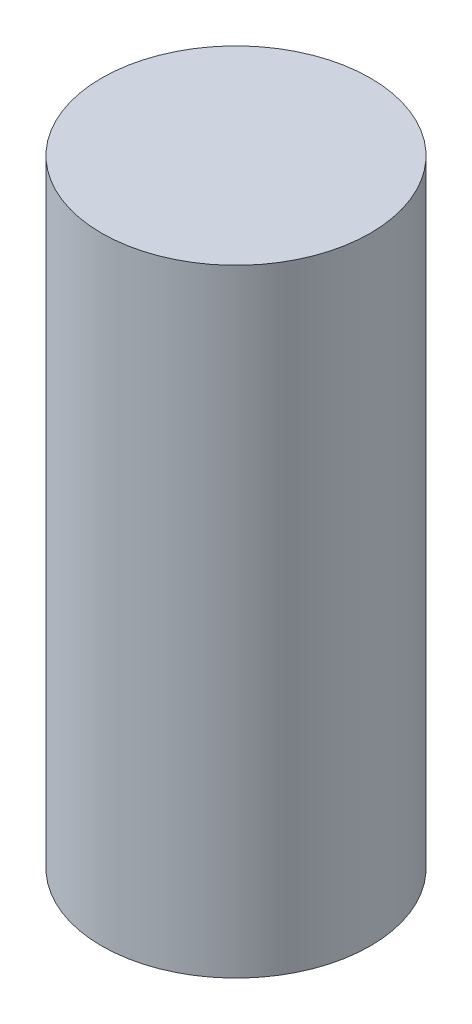
from build123d import *

# Parameters (mm, degrees)
SKETCH1_R           = 12.3
BOSS_EXTRUDE1_DEPTH = 56.5
SKETCH2_R           = 10
CUT_EXTRUDE1_DEPTH  = 6.5


with BuildPart() as part:
    # Sketch1 → Boss-Extrude1 (new body)
    with BuildSketch(Plane(origin=(0, 0, 0), x_dir=(1, 0, 0), z_dir=(0, 1, 0))):
        with Locations(Location((0, 0, 0), (0, 0, 270))):
            Circle(SKETCH1_R)
    extrude(amount=BOSS_EXTRUDE1_DEPTH)

    # Sketch2 → Cut-Extrude1 (cut)
    with BuildSketch(Plane.XZ):
        with Locations(Location((0, 0, 0), (0, 0, 270))):
            Circle(SKETCH2_R)
    extrude(amount=-CUT_EXTRUDE1_DEPTH, mode=Mode.SUBTRACT)


solid = part.part
